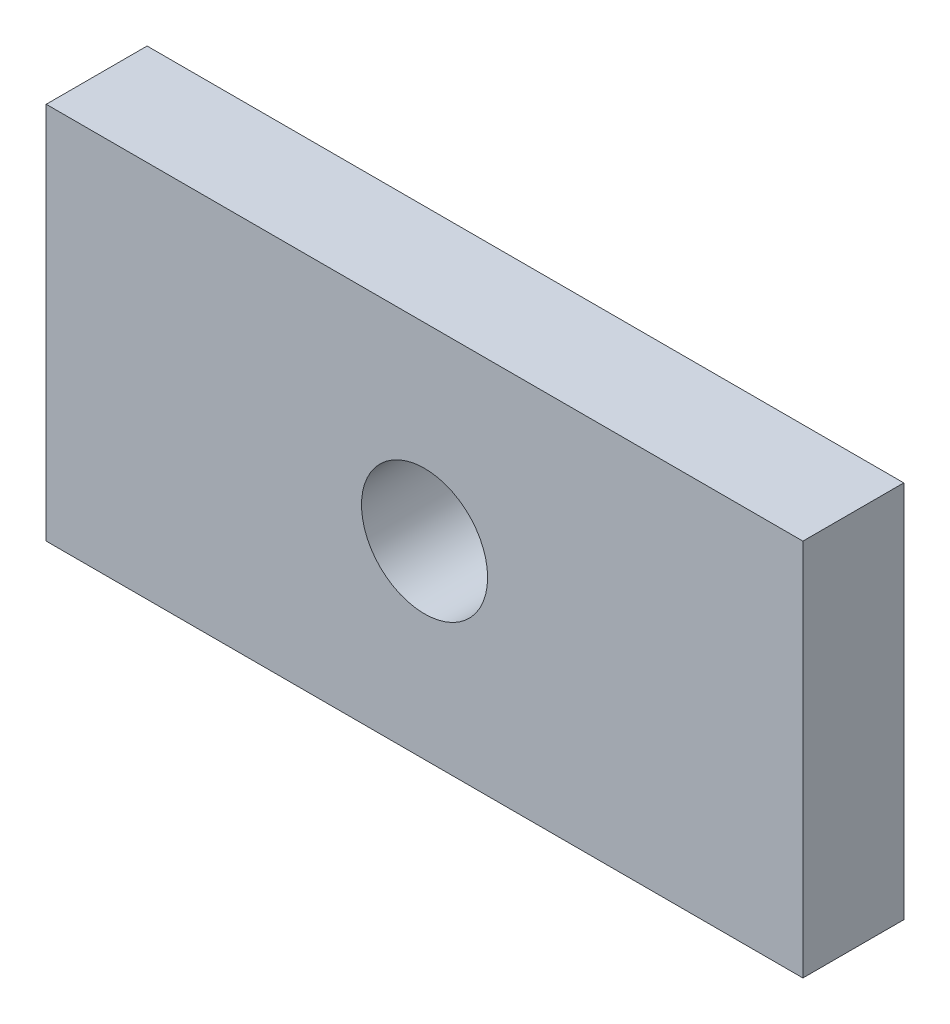
from build123d import *

# Parameters (mm, degrees)
SKETCH_2_W          = 300
SKETCH_2_H          = 150
EXTRUDE_1_DEPTH     = 40
SKETCH_3_R          = 25
CUT_EXTRUDE_1_DEPTH = 40


with BuildPart() as part:
    # 草图2 → 凸台-拉伸1 (new body)
    with BuildSketch(Plane.XY):
        Rectangle(SKETCH_2_W, SKETCH_2_H)
    extrude(amount=EXTRUDE_1_DEPTH)

    # 草图3 → 切除-拉伸1 (cut)
    with BuildSketch(Plane.XY.offset(40)):
        Circle(SKETCH_3_R)
    extrude(amount=-CUT_EXTRUDE_1_DEPTH, mode=Mode.SUBTRACT)


solid = part.part
